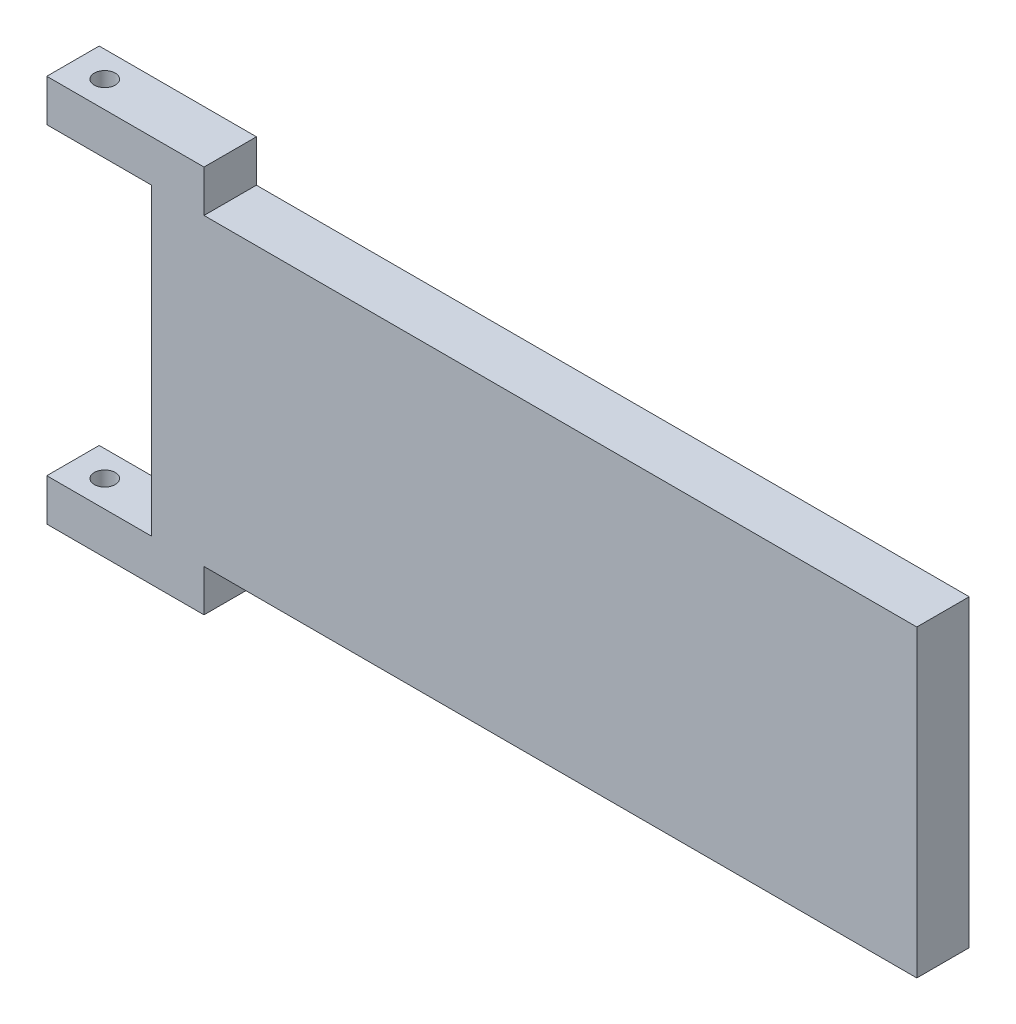
from build123d import *

# Parameters (mm, degrees)
SKETCH1_W           = 73
SKETCH1_H           = 29
BOSS_EXTRUDE1_DEPTH = 5
SKETCH2_R           = 1
CUT_EXTRUDE1_DEPTH  = 35


with BuildPart() as part:
    # Sketch1 → Boss-Extrude1 (new body)
    with BuildSketch(Plane.XY):
        with Locations((36.5, 14.5)):
            Rectangle(SKETCH1_W, SKETCH1_H)
        Polygon((-10, 29), (0, 29), (5, 29), (5, 33), (-10, 33), align=None)
        Polygon((5, 0), (0, 0), (-10, 0), (-10, -4), (5, -4), align=None)
    extrude(amount=BOSS_EXTRUDE1_DEPTH)

    # Sketch2 → Cut-Extrude1 (cut)
    with BuildSketch(Plane(origin=(0, 33, 0), x_dir=(1, 0, 0), z_dir=(0, 1, 0))):
        with Locations(Location((-7, -2.46940408, 0), (0, 0, 270))):
            Circle(SKETCH2_R)
    extrude(amount=-CUT_EXTRUDE1_DEPTH, mode=Mode.SUBTRACT)


solid = part.part
